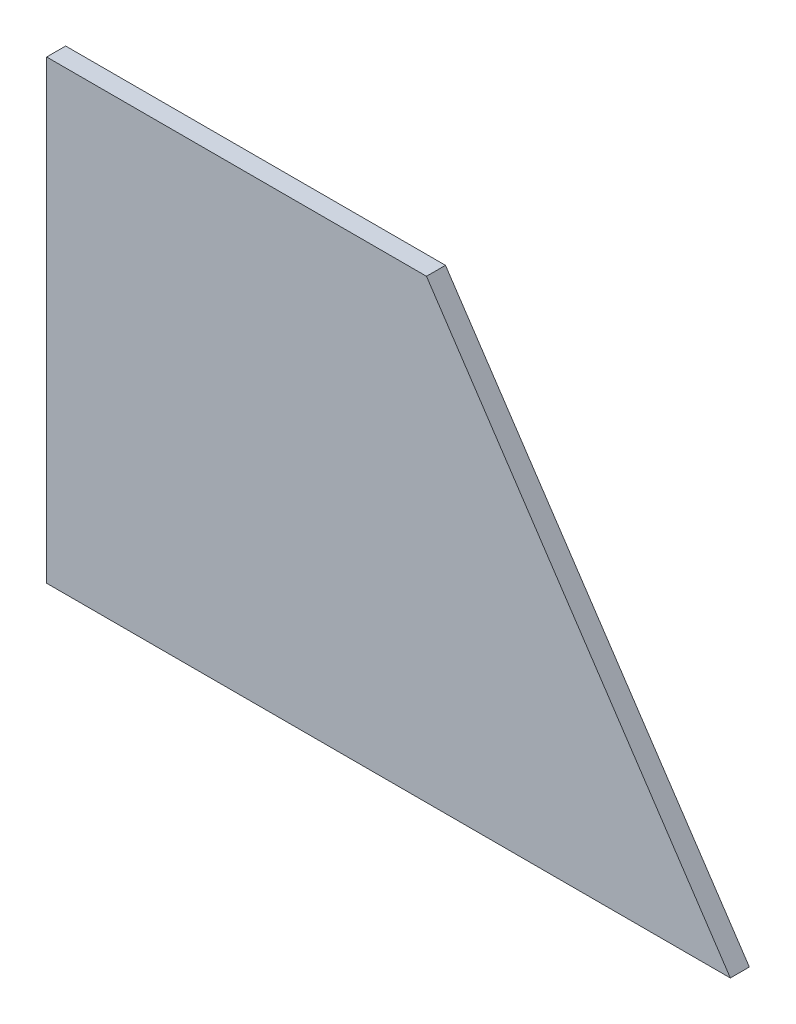
from build123d import *

# Parameters (mm, degrees)
BOSS_EXTRUDE1_DEPTH = 3.175
CUT_EXTRUDE1_DEPTH  = 3.175


with BuildPart() as part:
    # Sketch1 → Boss-Extrude1 (new body)
    with BuildSketch(Plane.XY):
        Polygon((0, 0), (165.1, 0), (114.3, 76.2), (50.8, 76.2), align=None)
    extrude(amount=BOSS_EXTRUDE1_DEPTH)

    # Sketch2 → Cut-Extrude1 (cut)
    with BuildSketch(Plane.XY.offset(3.175)):
        Polygon((50.8, 76.2), (50.8, 0), (0, 0), align=None)
    extrude(amount=-CUT_EXTRUDE1_DEPTH, mode=Mode.SUBTRACT)


solid = part.part
